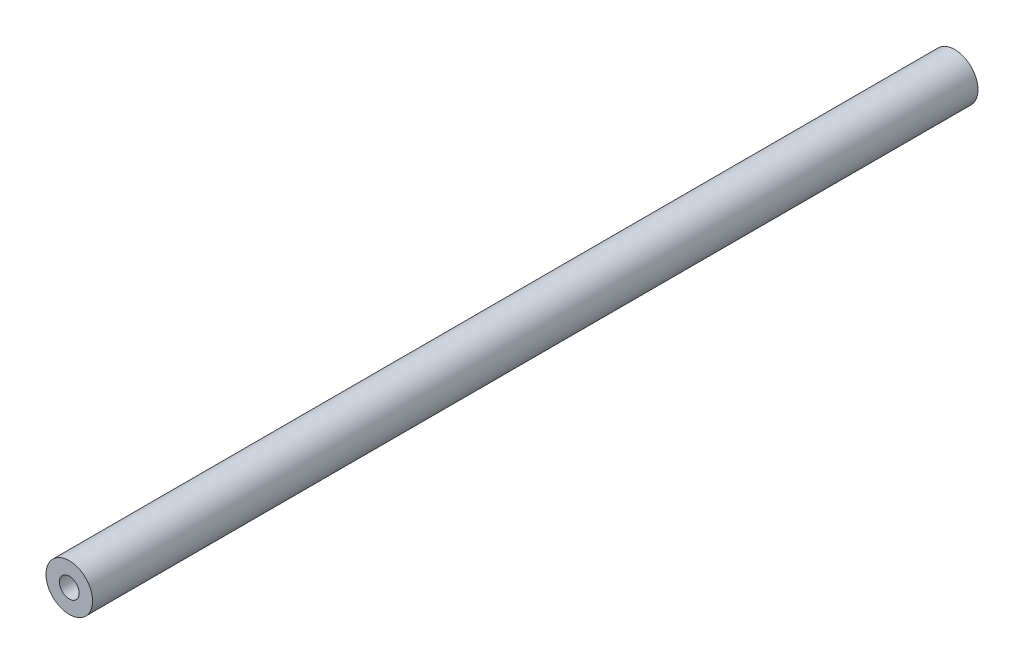
from build123d import *

# Parameters (mm, degrees)
SKETCH1_R                            = 4.7625
BOSS_EXTRUDE1_DEPTH                  = 90.4875
F_10_32_TAPPED_HOLE1_D               = 4.0386
F_10_32_TAPPED_HOLE1_DEPTH           = 11.938
F_10_32_TAPPED_HOLE1_TIP             = 1.213317848
F_10_32_TAPPED_HOLE1_ON_FACE_2_D     = 4.0386
F_10_32_TAPPED_HOLE1_ON_FACE_2_DEPTH = 11.938
F_10_32_TAPPED_HOLE1_ON_FACE_2_TIP   = 1.213317848


with BuildPart() as part:
    # Sketch1 → Boss-Extrude1 (new, symmetric)
    with BuildSketch(Plane.XY):
        Circle(SKETCH1_R)
    extrude(amount=BOSS_EXTRUDE1_DEPTH, both=True)

    # #10-32 Tapped Hole1
    with Locations(Plane.XY.offset(90.4875)):
        with Locations((0, 0)):
            Hole(F_10_32_TAPPED_HOLE1_D / 2, depth=F_10_32_TAPPED_HOLE1_DEPTH)
            with Locations((0, 0, -(F_10_32_TAPPED_HOLE1_DEPTH + F_10_32_TAPPED_HOLE1_TIP / 2))):  # 118° drill point
                Cone(0, F_10_32_TAPPED_HOLE1_D / 2, F_10_32_TAPPED_HOLE1_TIP, mode=Mode.SUBTRACT)

    # #10-32 Tapped Hole1 on face 2
    with Locations(Plane(origin=(0, 0, -90.4875), x_dir=(-1, 0, 0), z_dir=(0, 0, -1))):
        with Locations((0, 0)):
            Hole(F_10_32_TAPPED_HOLE1_ON_FACE_2_D / 2, depth=F_10_32_TAPPED_HOLE1_ON_FACE_2_DEPTH)
            with Locations((0, 0, -(F_10_32_TAPPED_HOLE1_ON_FACE_2_DEPTH + F_10_32_TAPPED_HOLE1_ON_FACE_2_TIP / 2))):  # 118° drill point
                Cone(0, F_10_32_TAPPED_HOLE1_ON_FACE_2_D / 2, F_10_32_TAPPED_HOLE1_ON_FACE_2_TIP, mode=Mode.SUBTRACT)


solid = part.part
